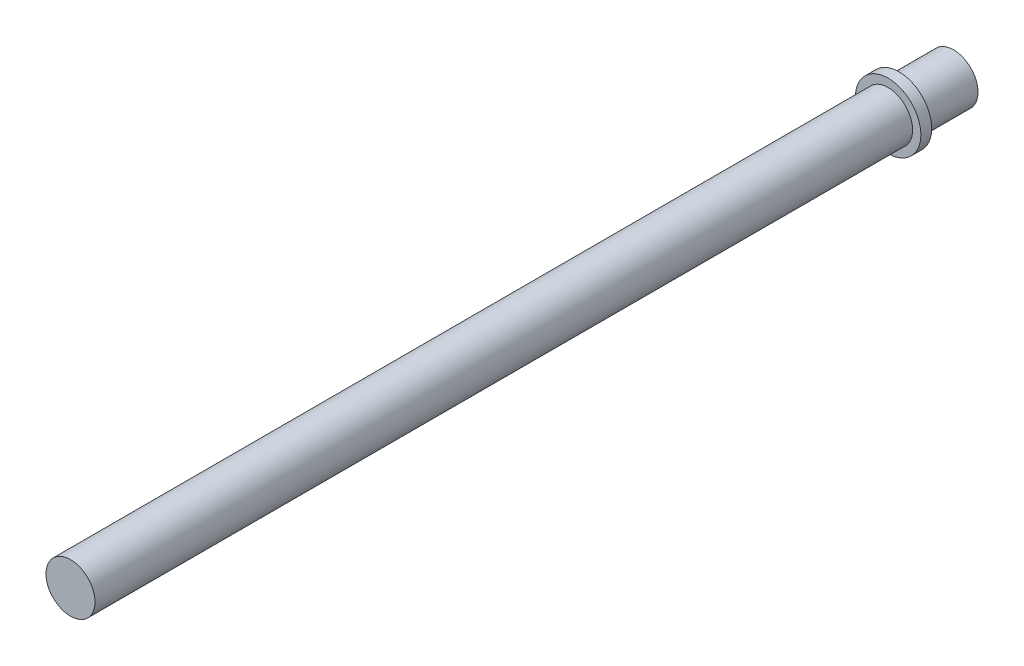
from build123d import *

# Parameters (mm, degrees)
SKETCH2_R           = 2.25
BOSS_EXTRUDE1_DEPTH = 75
SKETCH3_R           = 3
BOSS_EXTRUDE2_DEPTH = 1
BOSS_EXTRUDE3_START = 5
SKETCH4_R           = 2.25
BOSS_EXTRUDE3_DEPTH = 5


with BuildPart() as part:
    # Sketch2 → Boss-Extrude1 (new body)
    with BuildSketch(Plane.XY):
        Circle(SKETCH2_R)
    extrude(amount=BOSS_EXTRUDE1_DEPTH)

    # Sketch3 → Boss-Extrude2 (add)
    with BuildSketch(Plane(origin=(0, 0, 0), x_dir=(-1, 0, 0), z_dir=(0, 0, -1))):
        Circle(SKETCH3_R)
    extrude(amount=BOSS_EXTRUDE2_DEPTH)

    # Sketch4 → Boss-Extrude3 (add)
    with BuildSketch(Plane(origin=(0, 0, -1), x_dir=(-1, 0, 0), z_dir=(0, 0, -1)).offset(BOSS_EXTRUDE3_START)):
        Circle(SKETCH4_R)
    extrude(amount=-BOSS_EXTRUDE3_DEPTH)


solid = part.part
